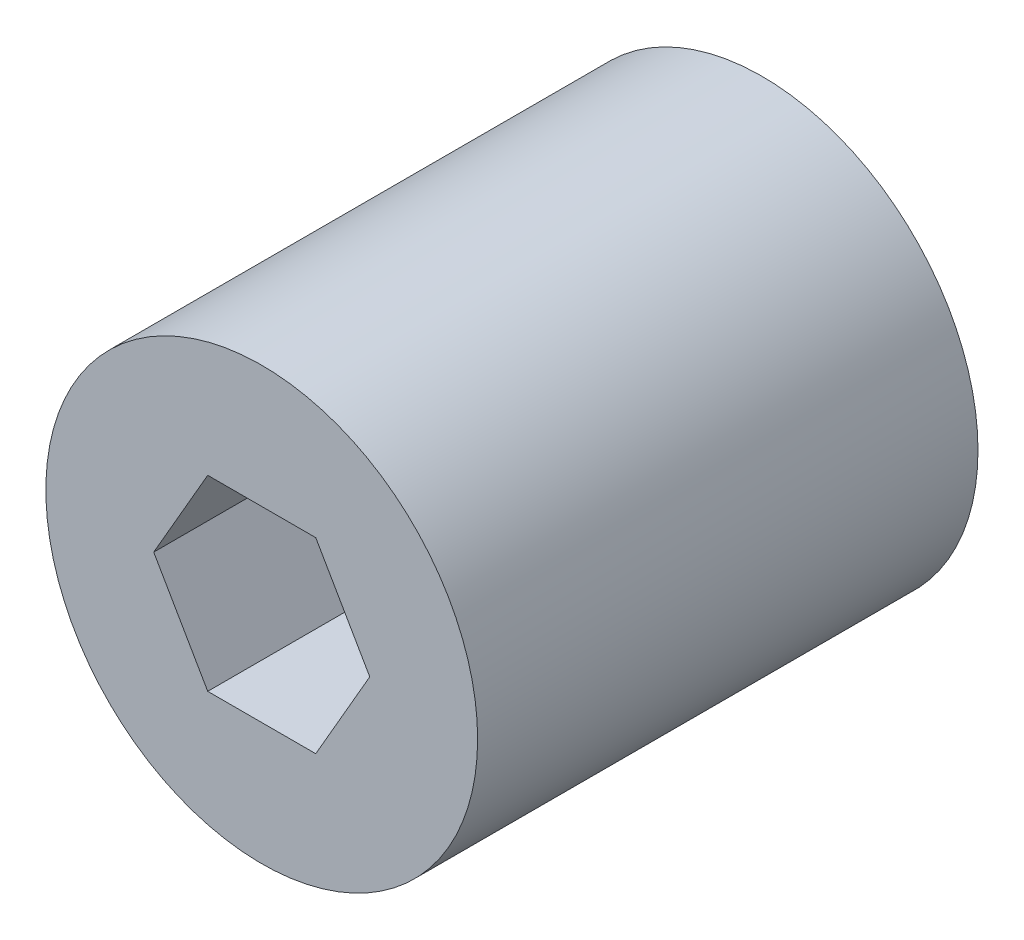
from build123d import *

# Parameters (mm, degrees)
SKETCH1_R           = 6
BOSS_EXTRUDE1_DEPTH = 13.90575


with BuildPart() as part:
    # Sketch1 → Boss-Extrude1 (new body)
    with BuildSketch(Plane.XY):
        Circle(SKETCH1_R)
        Polygon((3.0022214, 0), (1.5011107, 2.6), (-1.5011107, 2.6), (-3.0022214, 0), (-1.5011107, -2.6), (1.5011107, -2.6), align=None, mode=Mode.SUBTRACT)
    extrude(amount=BOSS_EXTRUDE1_DEPTH)


solid = part.part
